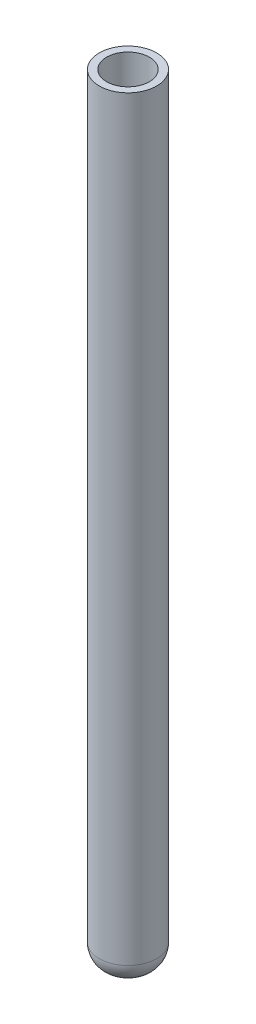
from build123d import *

# Parameters (mm, degrees)
FILLET1_R = 0.5


with BuildPart() as part:
    # Sketch1 → Revolve1 (revolve)
    with BuildSketch(Plane(origin=(0, 0, 0), x_dir=(0, 0, -1), z_dir=(1, 0, 0)), mode=Mode.PRIVATE) as revolve1_sk:
        Polygon((0.51, 0), (0.51, -10), (0, -10), (0, -18.54), (0.685, -18.54), (0.685, 0), align=None)
    revolve(revolve1_sk.sketch.rotate(Axis((0, -10, 0), (0, -1, 0)), 180), axis=Axis((0, -10, 0), (0, -1, 0)))

    # Fillet1
    fillet1_edges = [part.edges().sort_by_distance(p)[0] for p in [
        (0, -18.54, -0.685),
    ]]
    fillet(fillet1_edges, radius=FILLET1_R)


solid = part.part
